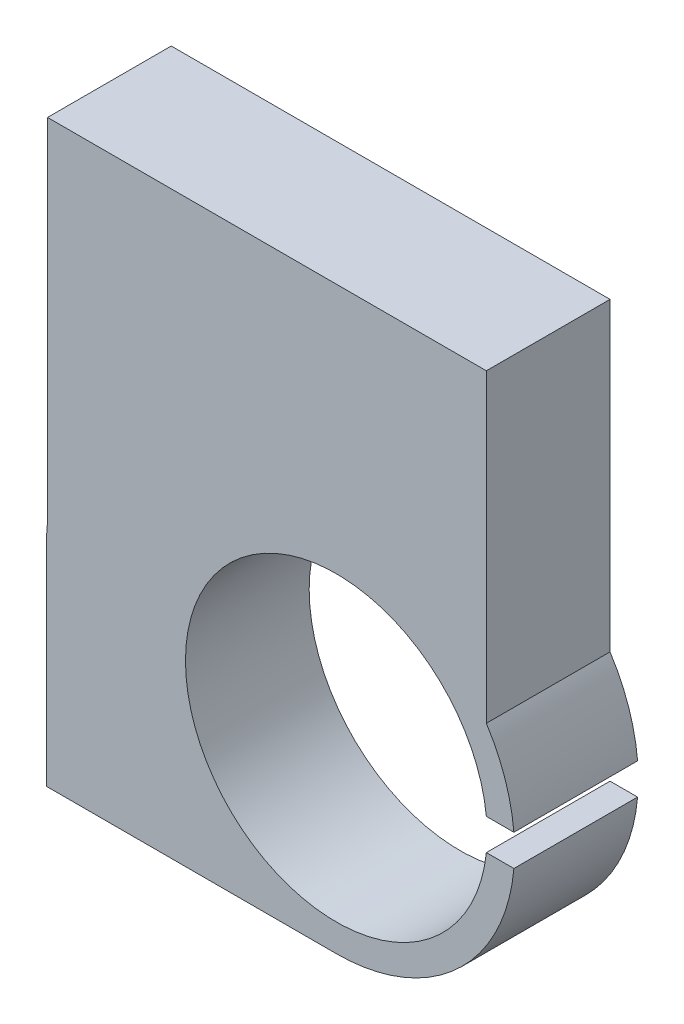
from build123d import *

# Parameters (mm, degrees)
BOSS_EXTRUDE3_DEPTH = 28
FILLET1_R           = 10
SKETCH8_R           = 9.5
SKETCH8_W           = 8
SKETCH8_H           = 5
CUT_EXTRUDE4_DEPTH  = 5
SKETCH10_R          = 1.75
CUT_EXTRUDE6_DEPTH  = 10
CUT_EXTRUDE9_DEPTH  = 5
SKETCH11_W          = 178.461857567
SKETCH11_H          = 75.855450753
CUT_EXTRUDE7_DEPTH  = 56
SKETCH15_W          = 24.76037583
SKETCH15_H          = 40.698494869
CUT_EXTRUDE10_DEPTH = 39


with BuildPart() as part:
    # Sketch7 → Boss-Extrude3 (new body)
    with BuildSketch(Plane.XY):
        with BuildLine():
            Line((-29.009247715, -3.56026037), (114.990752285, -3.56026037))
            ThreePointArc((114.990752285, -3.56026037), (122.672406567, -0.574706865), (126.321710983, 6.81473963))
            Line((126.321710983, 6.81473963), (124.563663285, 6.81473963))
            ThreePointArc((124.563663285, 6.81473963), (105.365752285, 7.81473963), (124.563663285, 8.81473963))
            Line((124.563663285, 8.81473963), (126.321710983, 8.81473963))
            ThreePointArc((126.321710983, 8.81473963), (125.754505842, 11.49335817), (124.563663285, 13.958842494))
            Line((124.563663285, 13.958842494), (124.563663285, 33.43973963))
            Line((124.563663285, 33.43973963), (96.563663285, 33.43973963))
            Line((96.563663285, 33.43973963), (96.563663285, 1.43973963))
            Line((96.563663285, 1.43973963), (-10.582158714, 1.43973963))
            Line((-10.582158714, 1.43973963), (-10.582158714, 33.43973963))
            Line((-10.582158714, 33.43973963), (-38.582158714, 33.43973963))
            Line((-38.582158714, 33.43973963), (-38.582158714, 13.958842494))
            ThreePointArc((-38.582158714, 13.958842494), (-39.773001272, 11.49335817), (-40.340206412, 8.81473963))
            Line((-40.340206412, 8.81473963), (-38.582158714, 8.81473963))
            ThreePointArc((-38.582158714, 8.81473963), (-19.384247715, 7.81473963), (-38.582158714, 6.81473963))
            Line((-38.582158714, 6.81473963), (-40.340206412, 6.81473963))
            ThreePointArc((-40.340206412, 6.81473963), (-36.690901996, -0.574706865), (-29.009247715, -3.56026037))
        make_face()
    extrude(amount=BOSS_EXTRUDE3_DEPTH)

    # Fillet1
    fillet1_edges = [part.edges().sort_by_distance(p)[0] for p in [
        (-10.582158714, 1.43973963, 14),
        (96.563663285, 1.43973963, 14),
    ]]
    fillet(fillet1_edges, radius=FILLET1_R)

    # Sketch8 → Cut-Extrude4 (cut)
    with BuildSketch(Plane(origin=(0, 1.43973963, 0), x_dir=(1, 0, 0), z_dir=(0, 1, 0))):
        with Locations(Location((63.990752285, -14, 0), (0, 0, 270))):
            Circle(SKETCH8_R)
        with Locations(Location((21.990752285, -14, 0), (0, 0, 270))):
            Circle(SKETCH8_R)
        with Locations((42.990752285, -14)):
            Rectangle(SKETCH8_W, SKETCH8_H)
    extrude(amount=-CUT_EXTRUDE4_DEPTH, mode=Mode.SUBTRACT)

    # Sketch10 → Cut-Extrude6 (cut)
    with BuildSketch(Plane(origin=(0, 33.43973963, 0), x_dir=(1, 0, 0), z_dir=(0, 1, 0))):
        with Locations(Location((110.490752285, -14, 0), (0, 0, 180))):
            Circle(SKETCH10_R)
        with Locations(Location((-24.509247715, -14, 0), (0, 0, 180))):
            Circle(SKETCH10_R)
    extrude(amount=-CUT_EXTRUDE6_DEPTH, mode=Mode.SUBTRACT)

    # Sketch13 → Cut-Extrude9 (cut)
    with BuildSketch(Plane(origin=(0, 33.43973963, 0), x_dir=(1, 0, 0), z_dir=(0, 1, 0))):
        Polygon((108.61436391, -17.25), (112.36714066, -17.25), (114.243529035, -14), (112.36714066, -10.75), (108.61436391, -10.75), (106.737975536, -14), align=None)
        Polygon((-20.756470965, -14), (-22.63285934, -10.75), (-26.38563609, -10.75), (-28.262024464, -14), (-26.38563609, -17.25), (-22.63285934, -17.25), align=None)
    extrude(amount=-CUT_EXTRUDE9_DEPTH, mode=Mode.SUBTRACT)

    # Sketch11 → Cut-Extrude7 (cut)
    with BuildSketch(Plane.XY.offset(28)):
        with Locations((7.260936379, 24.571309344)):
            Rectangle(SKETCH11_W, SKETCH11_H)
    extrude(amount=-CUT_EXTRUDE7_DEPTH, mode=Mode.SUBTRACT)

    # Sketch15 → Cut-Extrude10 (cut)
    with BuildSketch(Plane.ZY.offset(-96.491865162)):
        with Locations((20.2732889, 14.243484204)):
            Rectangle(SKETCH15_W, SKETCH15_H)
    extrude(amount=-CUT_EXTRUDE10_DEPTH, mode=Mode.SUBTRACT)


solid = part.part
